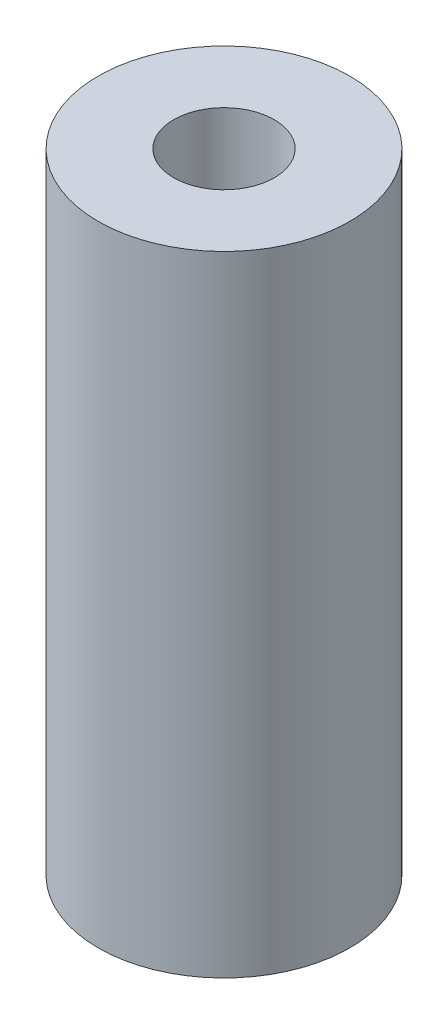
from build123d import *

# Parameters (mm, degrees)
SKETCH1_R           = 2.5
SKETCH1_R_2         = 1
BOSS_EXTRUDE1_DEPTH = 12.5


with BuildPart() as part:
    # Sketch1 → Boss-Extrude1 (new body)
    with BuildSketch(Plane(origin=(0, 0, 0), x_dir=(1, 0, 0), z_dir=(0, 1, 0))):
        with Locations(Location((0, 0, 0), (0, 0, 270))):
            Circle(SKETCH1_R)
        with Locations(Location((0, 0, 0), (0, 0, 270))):
            Circle(SKETCH1_R_2, mode=Mode.SUBTRACT)
    extrude(amount=BOSS_EXTRUDE1_DEPTH)


solid = part.part
